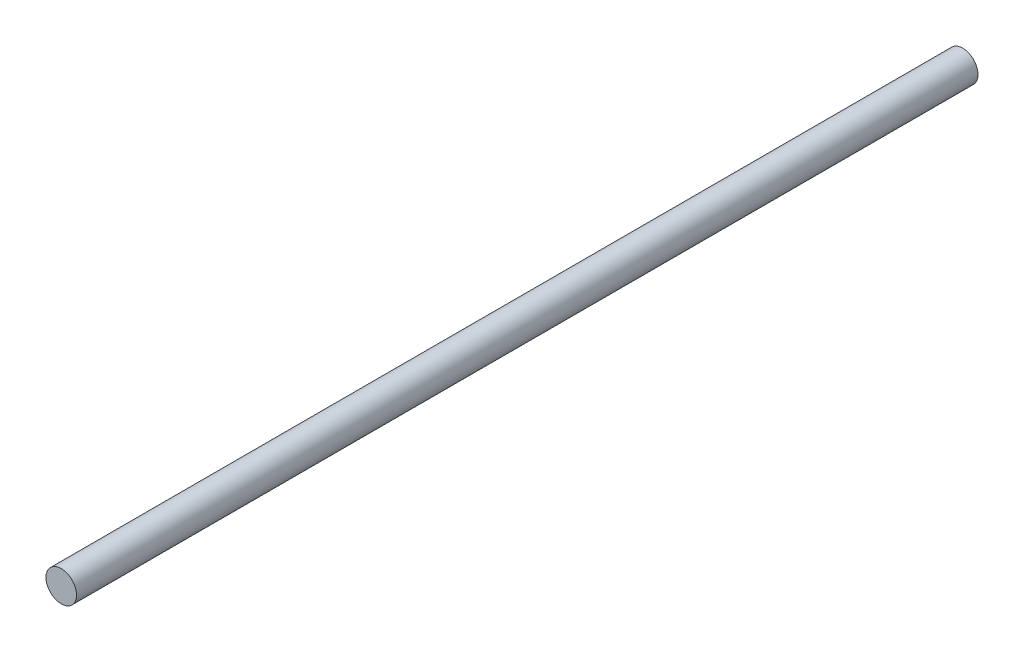
from build123d import *

# Parameters (mm, degrees)
ESBO_O1_R                = 5
RESSALTO_EXTRUS_O1_DEPTH = 147.5


with BuildPart() as part:
    # Esboço1 → Ressalto-extrusão1 (new, symmetric)
    with BuildSketch(Plane.XY):
        Circle(ESBO_O1_R)
    extrude(amount=RESSALTO_EXTRUS_O1_DEPTH, both=True)


solid = part.part
